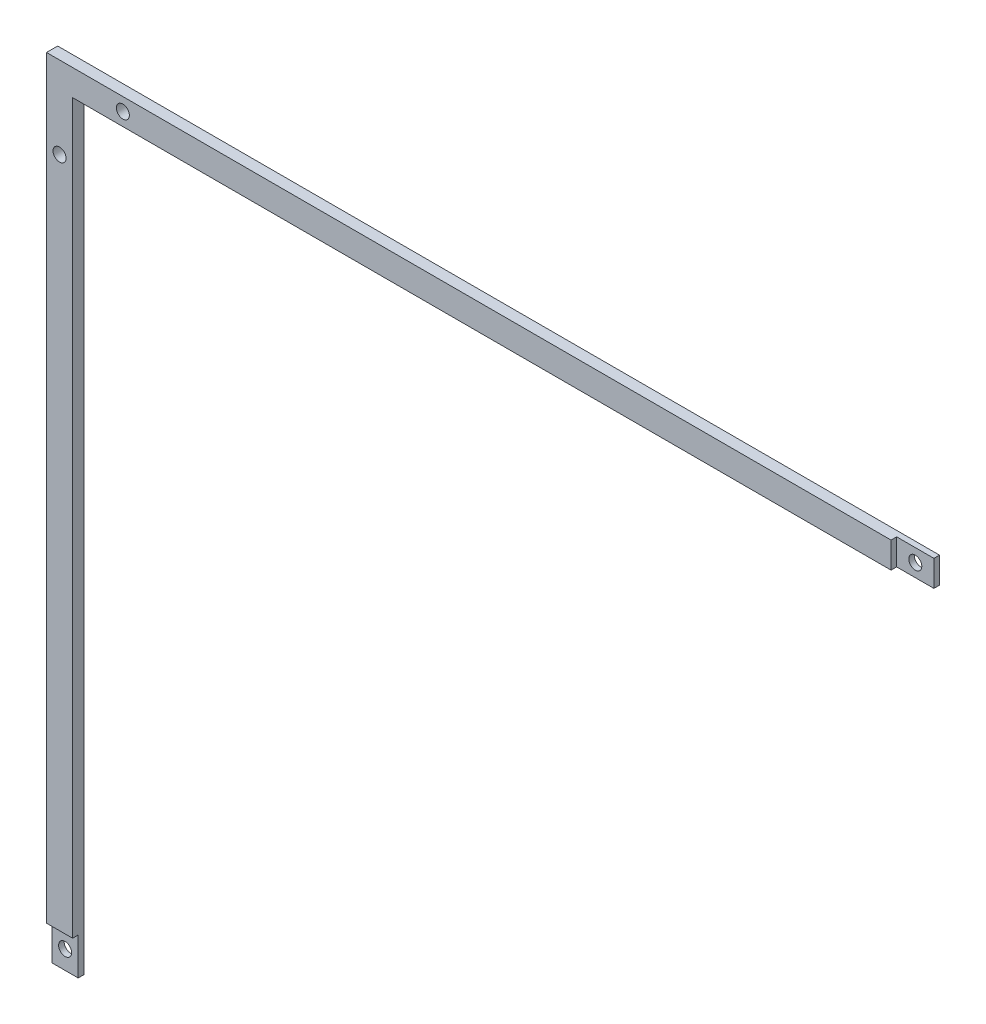
from build123d import *

# Parameters (mm, degrees)
CROQUIS3_R              = 1.75
SALIENTE_EXTRUIR1_DEPTH = 3
CORTAR_EXTRUIR1_START   = -1.5
CROQUIS4_W              = 7
CROQUIS4_H              = 10
CROQUIS4_R              = 1.75
CROQUIS4_W_2            = 10
CROQUIS4_H_2            = 7
CORTAR_EXTRUIR1_DEPTH   = 1.5


with BuildPart() as part:
    # Croquis3 → Saliente-Extruir1 (new body)
    with BuildSketch(Plane.XY):
        Polygon((483.811741117, -116.980180132), (483.811741117, -329.480180132), (490.811741117, -329.480180132), (490.811741117, -123.980180132), (720.611741117, -123.980180132), (720.611741117, -116.980180132), align=None)
        with Locations((487.311741117, -138.980180132)):
            Circle(CROQUIS3_R, mode=Mode.SUBTRACT)
        with Locations((487.311741117, -324.480180132)):
            Circle(CROQUIS3_R, mode=Mode.SUBTRACT)
        with Locations((504.311741117, -120.480180132)):
            Circle(CROQUIS3_R, mode=Mode.SUBTRACT)
        with Locations((715.611741117, -120.480180132)):
            Circle(CROQUIS3_R, mode=Mode.SUBTRACT)
    extrude(amount=SALIENTE_EXTRUIR1_DEPTH)

    # Croquis4 → Cortar-Extruir1 (cut)
    # profile 1 of 2: a face of its own
    with BuildSketch(Plane.XY.offset(3).offset(CORTAR_EXTRUIR1_START)):
        with Locations((487.311741117, -324.480180132)):
            Rectangle(CROQUIS4_W, CROQUIS4_H)
        with Locations((487.311741117, -324.480180132)):
            Circle(CROQUIS4_R, mode=Mode.SUBTRACT)
    # profile 2 of 2: a face of its own
    with BuildSketch(Plane.XY.offset(3).offset(CORTAR_EXTRUIR1_START)):
        with Locations((715.611741117, -120.480180132)):
            Rectangle(CROQUIS4_W_2, CROQUIS4_H_2)
        with Locations((715.611741117, -120.480180132)):
            Circle(CROQUIS4_R, mode=Mode.SUBTRACT)
    extrude(amount=CORTAR_EXTRUIR1_DEPTH, mode=Mode.SUBTRACT)


solid = part.part
